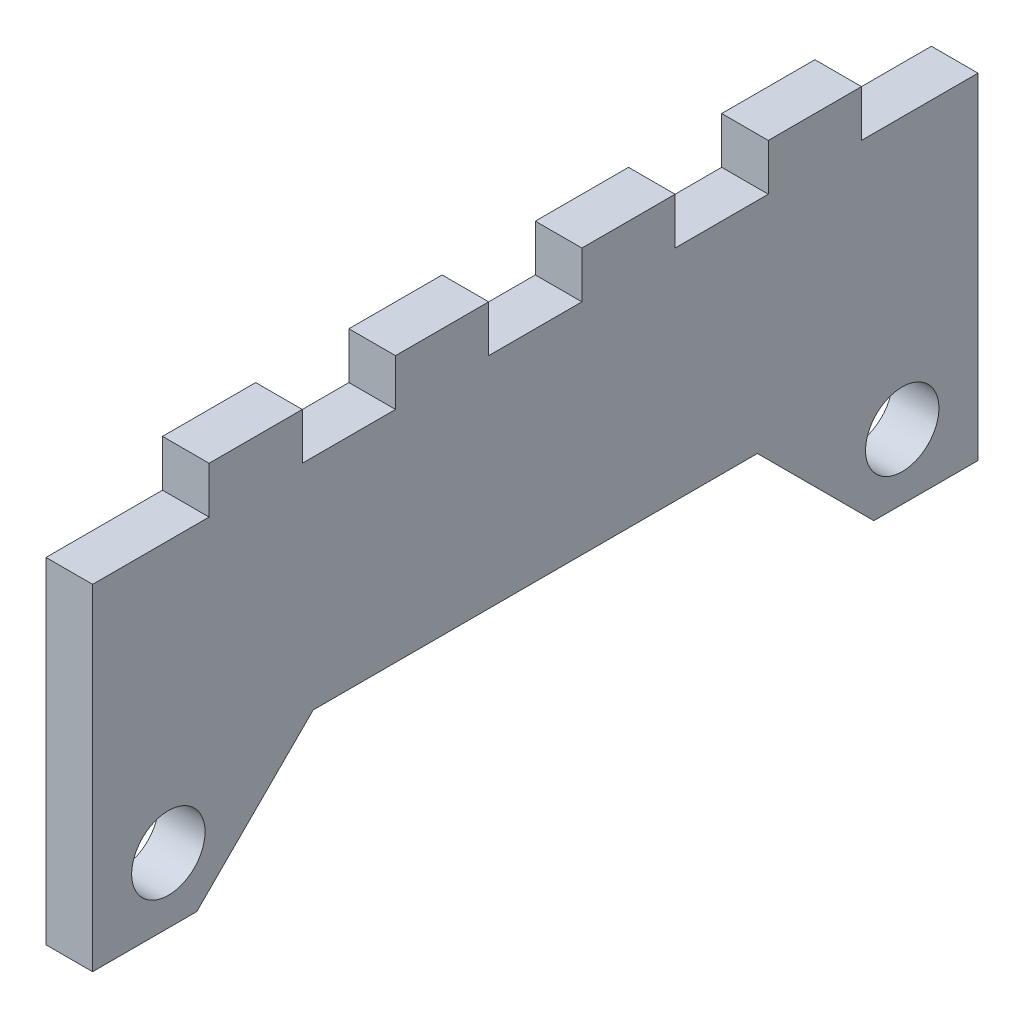
from build123d import *

# Parameters (mm, degrees)
SKETCH1_R           = 2.5
BOSS_EXTRUDE1_DEPTH = 3.175


with BuildPart() as part:
    # Sketch1 → Boss-Extrude1 (new body)
    with BuildSketch(Plane(origin=(0, 0, 0), x_dir=(0, 0, -1), z_dir=(1, 0, 0))):
        Polygon((0, 0), (7.096461031, 0), (15.026461031, 7.93), (45.298538969, 7.93), (53.228538969, 0), (60.325, 0), (60.325, 22.86), (52.3875, 22.86), (52.3875, 26.035), (46.0375, 26.035), (46.0375, 22.86), (39.6875, 22.86), (39.6875, 26.035), (33.3375, 26.035), (33.3375, 22.86), (26.9875, 22.86), (26.9875, 26.035), (20.6375, 26.035), (20.6375, 22.86), (14.2875, 22.86), (14.2875, 26.035), (7.9375, 26.035), (7.9375, 22.86), (0, 22.86), align=None)
        with Locations((5.1625, 4.43)):
            Circle(SKETCH1_R, mode=Mode.SUBTRACT)
        with Locations(Location((55.1625, 4.43, 0), (0, 0, 180))):
            Circle(SKETCH1_R, mode=Mode.SUBTRACT)
    extrude(amount=BOSS_EXTRUDE1_DEPTH)


solid = part.part
